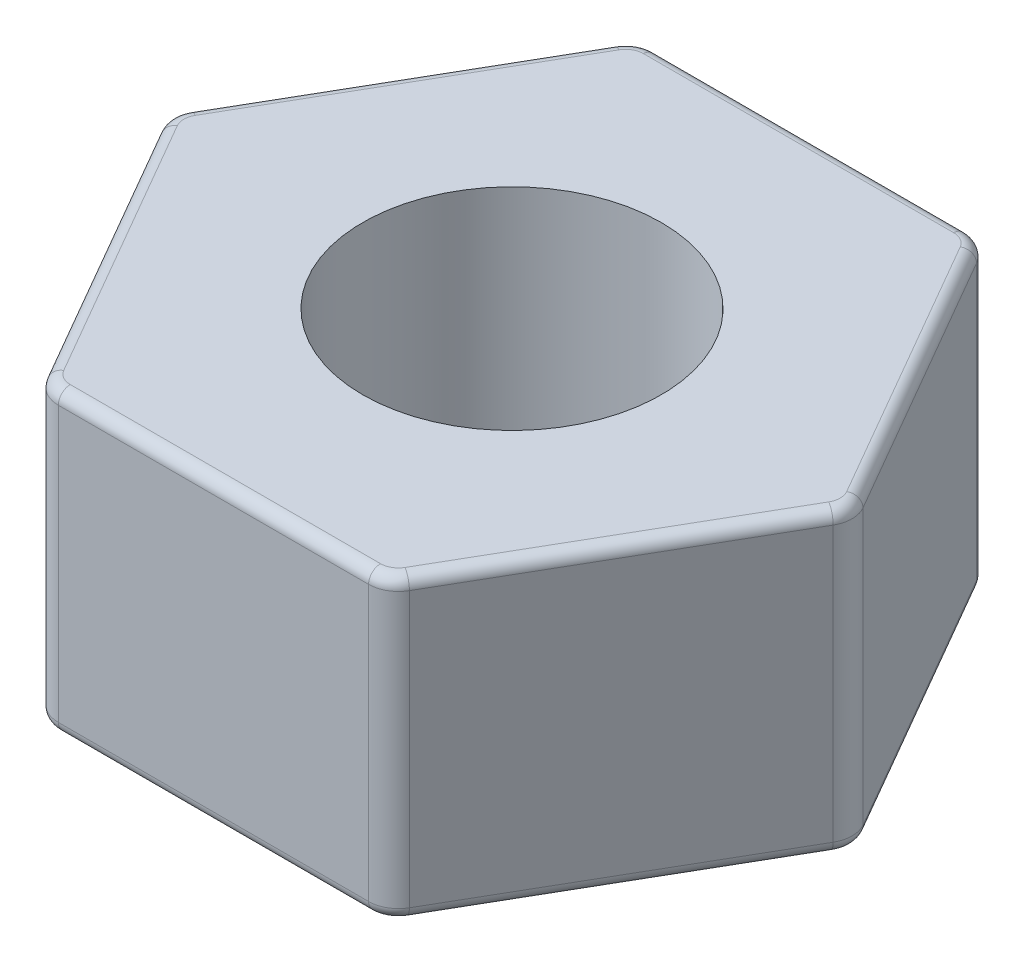
from build123d import *

# Parameters (mm, degrees)
CROQUIS1_R              = 2.5
SALIENTE_EXTRUIR1_DEPTH = 5
REDONDEO1_R             = 0.5
REDONDEO2_R             = 0.2


with BuildPart() as part:
    # Croquis1 → Saliente-Extruir1 (new body)
    with BuildSketch(Plane(origin=(0, 0, 0), x_dir=(1, 0, 0), z_dir=(0, 1, 0))):
        Polygon((-2.886751346, 5), (-5.773502692, 0), (-2.886751346, -5), (2.886751346, -5), (5.773502692, 0), (2.886751346, 5), align=None)
        with Locations(Location((0, 0, 0), (0, 0, 270))):
            Circle(CROQUIS1_R, mode=Mode.SUBTRACT)
    extrude(amount=SALIENTE_EXTRUIR1_DEPTH)

    # Redondeo1
    redondeo1_edges = [part.edges().sort_by_distance(p)[0] for p in [
        (2.886751346, 2.5, -5),
        (5.773502692, 2.5, 0),
        (2.886751346, 2.5, 5),
        (-2.886751346, 2.5, 5),
        (-5.773502692, 2.5, 0),
        (-2.886751346, 2.5, -5),
    ]]
    fillet(redondeo1_edges, radius=REDONDEO1_R)

    # Redondeo2
    redondeo2_edges = [part.edges().sort_by_distance(p)[0] for p in [
        (-4.330127019, 0, -2.5),
        (-4.330127019, 5, -2.5),
        (0, 0, -5),
        (4.330127019, 0, -2.5),
        (4.330127019, 0, 2.5),
        (0, 0, 5),
        (-4.330127019, 0, 2.5),
        (-2.848076211, 0, 4.933012702),
        (-5.696152423, 0, 0),
        (2.848076211, 0, 4.933012702),
        (5.696152423, 0, 0),
        (2.848076211, 0, -4.933012702),
        (-2.848076211, 0, -4.933012702),
        (0, 5, -5),
        (-4.330127019, 5, 2.5),
        (0, 5, 5),
        (4.330127019, 5, 2.5),
        (4.330127019, 5, -2.5),
        (-2.848076211, 5, 4.933012702),
        (-5.696152423, 5, 0),
        (2.848076211, 5, 4.933012702),
        (5.696152423, 5, 0),
        (2.848076211, 5, -4.933012702),
        (-2.848076211, 5, -4.933012702),
    ]]
    fillet(redondeo2_edges, radius=REDONDEO2_R)


solid = part.part
